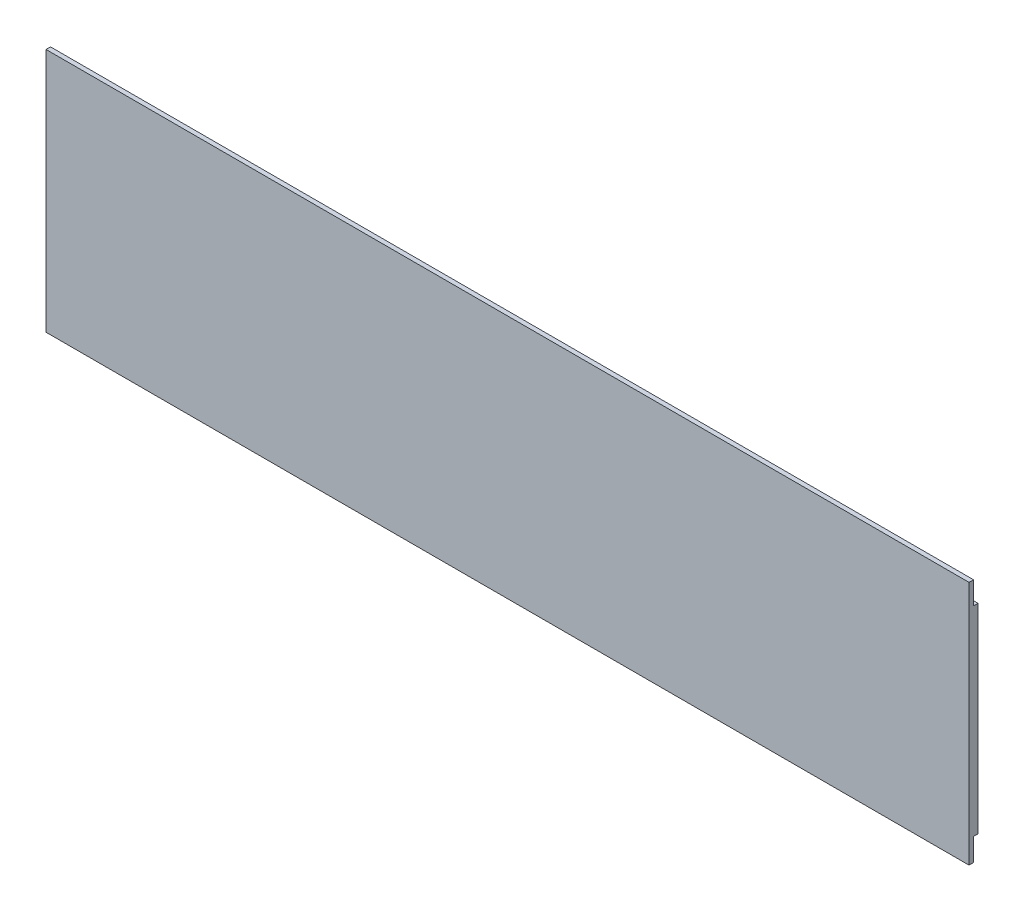
from build123d import *

# Parameters (mm, degrees)
SKETCH1_W           = 326.228
SKETCH1_H           = 86.566214515
BOSS_EXTRUDE1_DEPTH = 3.175
SKETCH3_W           = 326.228
SKETCH3_H           = 8
CUT_EXTRUDE2_DEPTH  = 1.5875


with BuildPart() as part:
    # Sketch1 → Boss-Extrude1 (new body)
    with BuildSketch(Plane.XY):
        with Locations((163.114, 43.283107257)):
            Rectangle(SKETCH1_W, SKETCH1_H)
    extrude(amount=BOSS_EXTRUDE1_DEPTH)

    # Sketch3 → Cut-Extrude2 (cut)
    with BuildSketch(Plane(origin=(0, 0, 0), x_dir=(-1, 0, 0), z_dir=(0, 0, -1))):
        with Locations((-163.114, 4)):
            Rectangle(SKETCH3_W, SKETCH3_H)
        with Locations((-163.114, 82.566214515)):
            Rectangle(SKETCH3_W, SKETCH3_H)
    extrude(amount=-CUT_EXTRUDE2_DEPTH, mode=Mode.SUBTRACT)


solid = part.part
